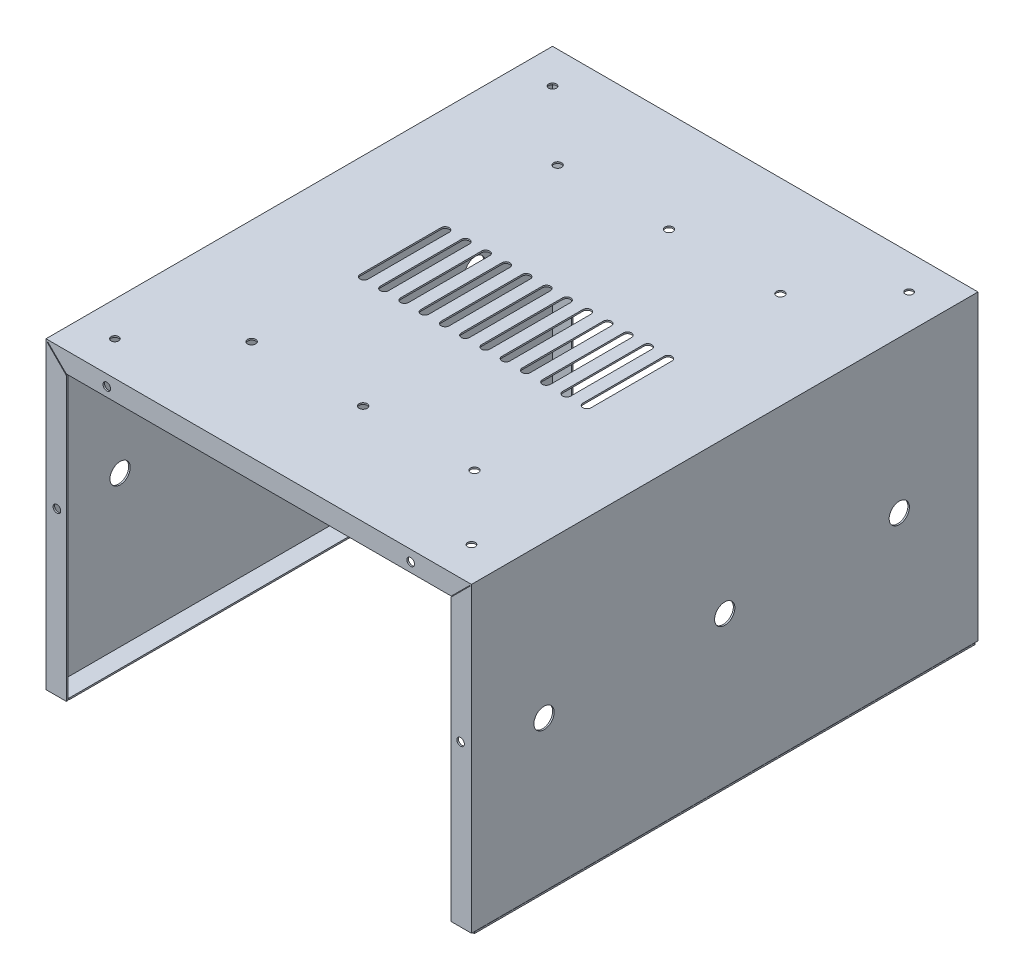
from build123d import *

# Parameters (mm, degrees)
SALIENTE_EXTRUIR1_DEPTH = 250
CROQUIS2_R              = 5
CORTAR_EXTRUIR1_DEPTH   = 41
SALIENTE_EXTRUIR2_DEPTH = 0.75
SALIENTE_EXTRUIR3_DEPTH = 0.75
CROQUIS6_W              = 10.03598264
CROQUIS6_H              = 247.177839244
CROQUIS6_W_2            = 9.889027718
SALIENTE_EXTRUIR4_DEPTH = 0.75
CROQUIS7_R              = 1.875
CORTAR_EXTRUIR2_DEPTH   = 25.75
CORTAR_EXTRUIR3_DEPTH   = 25.75
CROQUIS9_R              = 1.875
CORTAR_EXTRUIR4_DEPTH   = 269.75
CROQUIS10_R             = 5
CORTAR_EXTRUIR5_DEPTH   = 269.75
CROQUIS11_R             = 2
CORTAR_EXTRUIR6_DEPTH   = 10


with BuildPart() as part:
    # Croquis1 → Saliente-Extruir1 (new body)
    with BuildSketch(Plane.XY):
        Polygon((-105, 0), (-105, 150), (105, 150), (105, 0.86382522), (104.25, 0.86382522), (104.25, 149.25), (-104.25, 149.25), (-104.25, 0), align=None)
    extrude(amount=-SALIENTE_EXTRUIR1_DEPTH)

    # Croquis2 → Cortar-Extruir1 (cut)
    with BuildSketch(Plane.ZY.offset(105)):
        with Locations((-238.968044947, 123.121485212)):
            Circle(CROQUIS2_R)
    extrude(amount=-CORTAR_EXTRUIR1_DEPTH, mode=Mode.SUBTRACT)

    # Croquis3 → Saliente-Extruir2 (add)
    with BuildSketch(Plane.XY):
        Polygon((-105, 150), (-95, 140), (95, 140), (105, 150), align=None)
        Polygon((-105, 149.385141578), (-95, 139.385141578), (-95, 0), (-105, 0), align=None)
        Polygon((105, 149.615707019), (95, 139.615707019), (95, 0.86382522), (105, 0.86382522), align=None)
    extrude(amount=-SALIENTE_EXTRUIR2_DEPTH)

    # Croquis4 → Saliente-Extruir3 (add)
    with BuildSketch(Plane(origin=(0, 0, -250), x_dir=(-1, 0, 0), z_dir=(0, 0, -1))):
        Polygon((-105, 150), (-95, 140), (95, 140), (105, 150), align=None)
        Polygon((105, 149.270726288), (95, 139.385141578), (95, 0), (105, 0), align=None)
        Polygon((-95, 139.615707019), (-105, 149.615707019), (-105, 0.86382522), (-95, 0.86382522), align=None)
    extrude(amount=-SALIENTE_EXTRUIR3_DEPTH)

    # Croquis6 → Saliente-Extruir4 (add)
    with BuildSketch(Plane.XZ):
        with Locations((-99.98200868, -124.970111829)):
            Rectangle(CROQUIS6_W, CROQUIS6_H)
        with Locations((100.055486141, -124.970111829)):
            Rectangle(CROQUIS6_W_2, CROQUIS6_H)
    extrude(amount=-SALIENTE_EXTRUIR4_DEPTH)


with BuildPart() as saliente_extruir4_piece_1:
    # of the separate pieces the step leaves, piece 1, a body of its own (saliente_extruir4_pieces)
    add(part.part.solids().sort_by_distance((-105, 0, 0))[0])

    # Croquis7 → Cortar-Extruir2 (cut)
    with BuildSketch(Plane(origin=(0, 150, 0), x_dir=(1, 0, 0), z_dir=(0, 1, 0))):
        with Locations(Location((-88, 233, 0), (0, 0, 270))):
            Circle(CROQUIS7_R)
        with Locations(Location((88, 233, 0), (0, 0, 270))):
            Circle(CROQUIS7_R)
        with Locations(Location((88, 17, 0), (0, 0, 270))):
            Circle(CROQUIS7_R)
        with Locations(Location((-88, 17, 0), (0, 0, 270))):
            Circle(CROQUIS7_R)
    extrude(amount=-CORTAR_EXTRUIR2_DEPTH, mode=Mode.SUBTRACT)

    # Croquis8 → Cortar-Extruir3 (cut)
    with BuildSketch(Plane(origin=(0, 150, 0), x_dir=(1, 0, 0), z_dir=(0, 1, 0))):
        with BuildLine():
            Line((-55, 145), (-55, 105))
            ThreePointArc((-55, 105), (-53, 103), (-51, 105))
            Line((-51, 105), (-51, 145))
            ThreePointArc((-51, 145), (-53, 147), (-55, 145))
        make_face()
        with BuildLine():
            Line((-41, 105), (-41, 145))
            ThreePointArc((-41, 145), (-43, 147), (-45, 145))
            Line((-45, 145), (-45, 105))
            ThreePointArc((-45, 105), (-43, 103), (-41, 105))
        make_face()
        with BuildLine():
            Line((-31, 105), (-31, 145))
            ThreePointArc((-31, 145), (-33, 147), (-35, 145))
            Line((-35, 145), (-35, 105))
            ThreePointArc((-35, 105), (-33, 103), (-31, 105))
        make_face()
        with BuildLine():
            Line((-21, 105), (-21, 145))
            ThreePointArc((-21, 145), (-23, 147), (-25, 145))
            Line((-25, 145), (-25, 105))
            ThreePointArc((-25, 105), (-23, 103), (-21, 105))
        make_face()
        with BuildLine():
            Line((-11, 105), (-11, 145))
            ThreePointArc((-11, 145), (-13, 147), (-15, 145))
            Line((-15, 145), (-15, 105))
            ThreePointArc((-15, 105), (-13, 103), (-11, 105))
        make_face()
        with BuildLine():
            Line((-1, 105), (-1, 145))
            ThreePointArc((-1, 145), (-3, 147), (-5, 145))
            Line((-5, 145), (-5, 105))
            ThreePointArc((-5, 105), (-3, 103), (-1, 105))
        make_face()
        with BuildLine():
            Line((9, 105), (9, 145))
            ThreePointArc((9, 145), (7, 147), (5, 145))
            Line((5, 145), (5, 105))
            ThreePointArc((5, 105), (7, 103), (9, 105))
        make_face()
        with BuildLine():
            Line((19, 105), (19, 145))
            ThreePointArc((19, 145), (17, 147), (15, 145))
            Line((15, 145), (15, 105))
            ThreePointArc((15, 105), (17, 103), (19, 105))
        make_face()
        with BuildLine():
            Line((29, 105), (29, 145))
            ThreePointArc((29, 145), (27, 147), (25, 145))
            Line((25, 145), (25, 105))
            ThreePointArc((25, 105), (27, 103), (29, 105))
        make_face()
        with BuildLine():
            Line((39, 105), (39, 145))
            ThreePointArc((39, 145), (37, 147), (35, 145))
            Line((35, 145), (35, 105))
            ThreePointArc((35, 105), (37, 103), (39, 105))
        make_face()
        with BuildLine():
            Line((49, 105), (49, 145))
            ThreePointArc((49, 145), (47, 147), (45, 145))
            Line((45, 145), (45, 105))
            ThreePointArc((45, 105), (47, 103), (49, 105))
        make_face()
        with BuildLine():
            Line((59, 105), (59, 145))
            ThreePointArc((59, 145), (57, 147), (55, 145))
            Line((55, 145), (55, 105))
            ThreePointArc((55, 105), (57, 103), (59, 105))
        make_face()
    extrude(amount=-CORTAR_EXTRUIR3_DEPTH, mode=Mode.SUBTRACT)

    # Croquis9 → Cortar-Extruir4 (cut)
    with BuildSketch(Plane.XY):
        with Locations((-99.625522087, 80)):
            Circle(CROQUIS9_R)
        with Locations((-75, 144.571811312)):
            Circle(CROQUIS9_R)
        with Locations((99.625522087, 80)):
            Circle(CROQUIS9_R)
        with Locations((75, 144.571811312)):
            Circle(CROQUIS9_R)
    extrude(amount=-CORTAR_EXTRUIR4_DEPTH, mode=Mode.SUBTRACT)

    # Croquis10 → Cortar-Extruir5 (cut)
    with BuildSketch(Plane(origin=(105, 0, 0), x_dir=(0, 0, -1), z_dir=(1, 0, 0))):
        with Locations(Location((125, 75, 0), (0, 0, 180))):
            Circle(CROQUIS10_R)
        with Locations(Location((211.145469255, 75, 0), (0, 0, 180))):
            Circle(CROQUIS10_R)
        with Locations(Location((35.82179683, 75, 0), (0, 0, 180))):
            Circle(CROQUIS10_R)
    extrude(amount=-CORTAR_EXTRUIR5_DEPTH, mode=Mode.SUBTRACT)

    # Croquis11 → Cortar-Extruir6 (cut)
    with BuildSketch(Plane.XZ.offset(-149.25)):
        with Locations(Location((-53, -49.5, 0), (0, 0, 270))):
            Circle(CROQUIS11_R)
        with Locations(Location((2, -49.5, 0), (0, 0, 270))):
            Circle(CROQUIS11_R)
        with Locations(Location((57, -49.5, 0), (0, 0, 270))):
            Circle(CROQUIS11_R)
        with Locations(Location((2, -200.5, 0), (0, 0, 270))):
            Circle(CROQUIS11_R)
        with Locations(Location((57, -200.5, 0), (0, 0, 270))):
            Circle(CROQUIS11_R)
        with Locations(Location((-53, -200.5, 0), (0, 0, 270))):
            Circle(CROQUIS11_R)
    extrude(amount=-CORTAR_EXTRUIR6_DEPTH, mode=Mode.SUBTRACT)


with BuildPart() as saliente_extruir4_piece_2:
    # of the separate pieces the step leaves, piece 2, a body of its own (saliente_extruir4_pieces)
    add(part.part.solids().sort_by_distance((95.110972282, 0, -1.381192207))[0])


solid = Compound([saliente_extruir4_piece_1.part, saliente_extruir4_piece_2.part])
